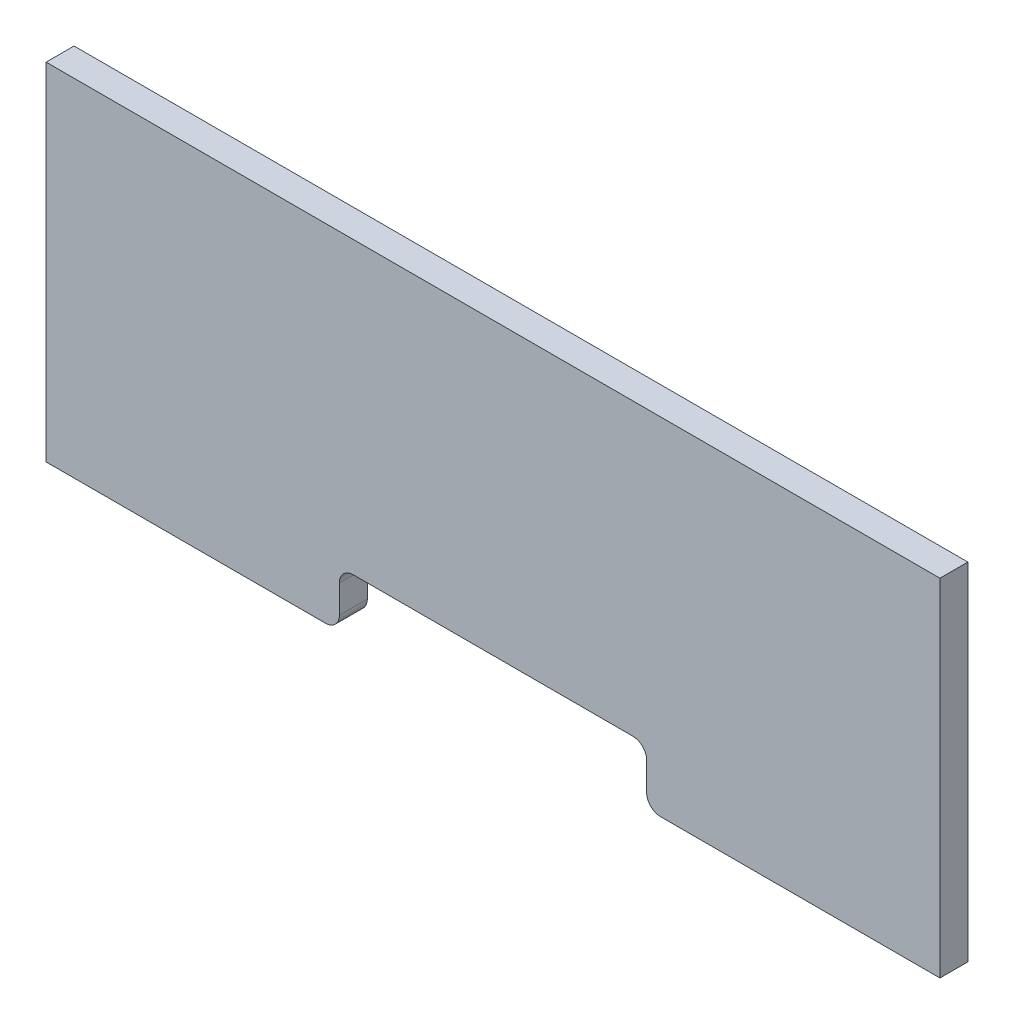
from build123d import *

# Parameters (mm, degrees)
SKETCH1_W           = 203.2
SKETCH1_H           = 78.7146
BOSS_EXTRUDE1_DEPTH = 6.35
SKETCH2_W           = 69.85
SKETCH2_H           = 12.7
CUT_EXTRUDE1_DEPTH  = 219.005850273
FILLET1_R           = 3.175


with BuildPart() as part:
    # Sketch1 → Boss-Extrude1 (new body)
    with BuildSketch(Plane.XY):
        with Locations((101.6, 39.3573)):
            Rectangle(SKETCH1_W, SKETCH1_H)
    extrude(amount=BOSS_EXTRUDE1_DEPTH)

    # Sketch2 → Cut-Extrude1 (cut, through all)
    with BuildSketch(Plane.XY.offset(6.35)):
        with Locations((101.6, 6.35)):
            Rectangle(SKETCH2_W, SKETCH2_H)
    extrude(amount=-CUT_EXTRUDE1_DEPTH, mode=Mode.SUBTRACT)

    # Fillet1
    fillet1_edges = [part.edges().sort_by_distance(p)[0] for p in [
        (66.675, 0, 3.175),
        (66.675, 12.7, 3.175),
        (136.525, 12.7, 3.175),
        (136.525, 0, 3.175),
    ]]
    fillet(fillet1_edges, radius=FILLET1_R)


solid = part.part
